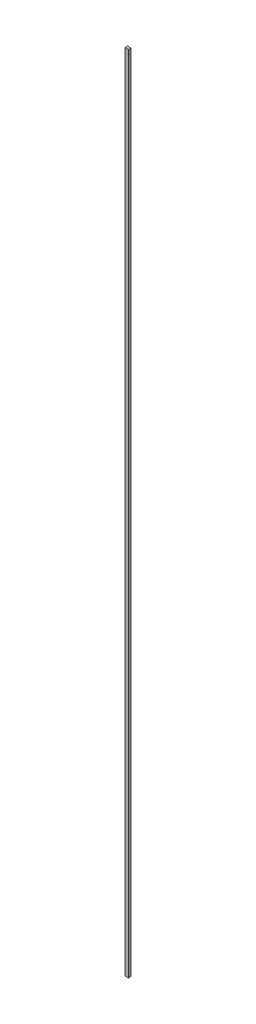
from build123d import *

# Parameters (mm, degrees)
BOSS_EXTRUDE1_DEPTH      = 736.6
BOSS_EXTRUDE1_DEPTH_BACK = 736.6
SKETCH1_W                = 6.35
SKETCH1_H                = 4.7625


with BuildPart() as part:
    # Sketch1 → Boss-Extrude1 (new, two sides: drawn at the far end of the back side and taken through both)
    with BuildSketch(Plane(origin=(0, 0, 0), x_dir=(1, 0, 0), z_dir=(0, 1, 0)).offset(-BOSS_EXTRUDE1_DEPTH_BACK)):
        Rectangle(SKETCH1_W, SKETCH1_H)
    extrude(amount=BOSS_EXTRUDE1_DEPTH + BOSS_EXTRUDE1_DEPTH_BACK)


solid = part.part
